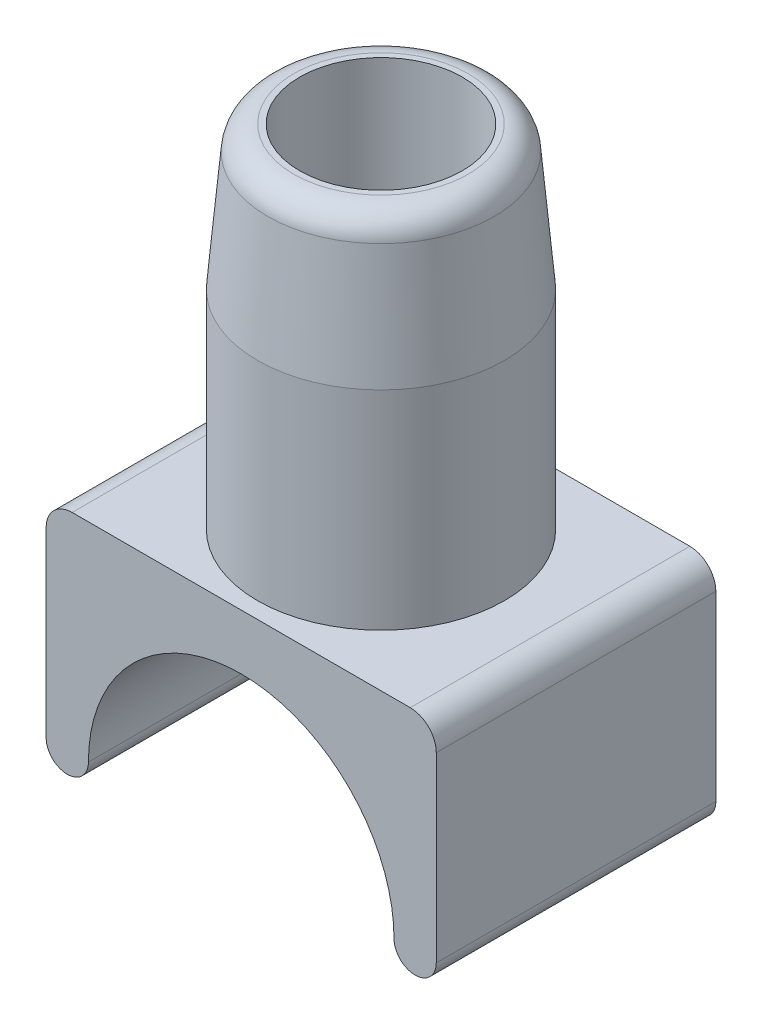
from build123d import *

# Parameters (mm, degrees)
BOSS_EXTRUDE1_DEPTH = 10.75
FILLET2_R           = 2


with BuildPart() as part:
    # Sketch1 → Boss-Extrude1 (new, symmetric)
    with BuildSketch(Plane.XY):
        with BuildLine():
            Line((-13, 0), (13, 0))
            ThreePointArc((13, 0), (14.414213562, -0.585786438), (15, -2))
            Line((15, -2), (15, -16))
            ThreePointArc((15, -16), (13.375, -17.625), (11.75, -16))
            ThreePointArc((11.75, -16), (0, -4.25), (-11.75, -16))
            ThreePointArc((-11.75, -16), (-13.375, -17.625), (-15, -16))
            Line((-15, -16), (-15, -2))
            ThreePointArc((-15, -2), (-14.414213562, -0.585786438), (-13, 0))
        make_face()
    extrude(amount=BOSS_EXTRUDE1_DEPTH, both=True)

    # Sketch3 → Revolve1 (revolve)
    with BuildSketch(Plane.XY, mode=Mode.PRIVATE) as revolve1_sk:
        Polygon((-9.5, 0), (-9.5, 16), (-8.537624701, 27), (-6.25, 27), (-6.25, 0), align=None)
    revolve(revolve1_sk.sketch.rotate(Axis((0, 13.186129828, 0), (0, -1, 0)), 270), axis=Axis((0, 13.186129828, 0), (0, -1, 0)))

    # Fillet2
    fillet2_edges = [part.edges().sort_by_distance(p)[0] for p in [
        (0, 27, -8.537624701),
    ]]
    fillet(fillet2_edges, radius=FILLET2_R)


solid = part.part
